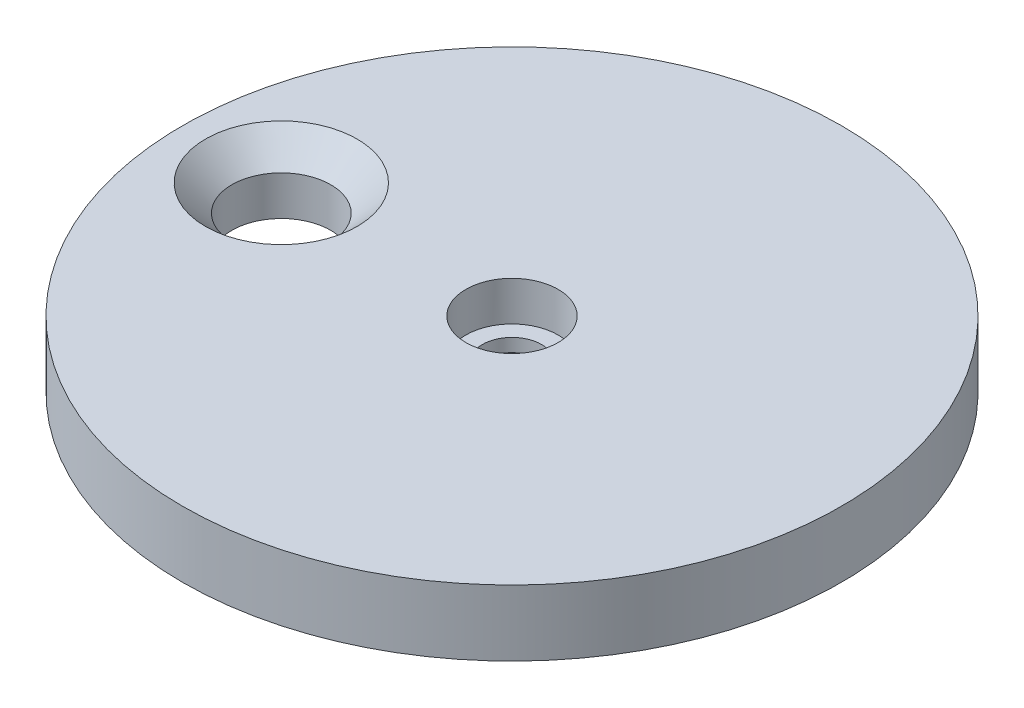
from build123d import *

# Parameters (mm, degrees)
SKETCH1_R           = 50
SKETCH1_R_2         = 7.5
BOSS_EXTRUDE1_DEPTH = 10
CHAMFER1_SIZE       = 4
CUT_EXTRUDE1_DEPTH  = 2
CUT_EXTRUDE2_REACH  = 73.162
SKETCH3_R           = 4.5
SKETCH4_R           = 1
CUT_EXTRUDE3_DEPTH  = 7
SKETCH7_R           = 7
CUT_EXTRUDE4_DEPTH  = 6


with BuildPart() as part:
    # Sketch1 → Boss-Extrude1 (new body)
    with BuildSketch(Plane(origin=(0, 0, 0), x_dir=(1, 0, 0), z_dir=(0, 1, 0))):
        with Locations(Location((0, 0, 0), (0, 0, 270))):
            Circle(SKETCH1_R)
        with Locations(Location((-35, 0, 0), (0, 0, 270))):
            Circle(SKETCH1_R_2, mode=Mode.SUBTRACT)
    extrude(amount=BOSS_EXTRUDE1_DEPTH)

    # Chamfer1
    chamfer1_edges = [part.edges().sort_by_distance(p)[0] for p in [
        (-35, 10, -7.5),
    ]]
    chamfer(chamfer1_edges, length=CHAMFER1_SIZE)

    # Sketch2 → Cut-Extrude1 (cut)
    with BuildSketch(Plane.XZ):
        with BuildLine():
            Line((-17, -2.5), (-4.43, -4.43))
            Line((-4.43, -4.43), (-2.5, -17))
            ThreePointArc((-2.5, -17), (0, -19.5), (2.5, -17))
            Line((2.5, -17), (4.43, -4.43))
            Line((4.43, -4.43), (17, -2.5))
            ThreePointArc((17, -2.5), (19.5, 0), (17, 2.5))
            Line((17, 2.5), (4.43, 4.43))
            Line((4.43, 4.43), (2.5, 17))
            ThreePointArc((2.5, 17), (0, 19.5), (-2.5, 17))
            Line((-2.5, 17), (-4.43, 4.43))
            Line((-4.43, 4.43), (-17, 2.5))
            ThreePointArc((-17, 2.5), (-19.5, 0), (-17, -2.5))
        make_face()
    extrude(amount=-CUT_EXTRUDE1_DEPTH, mode=Mode.SUBTRACT)

    # Sketch3 → Cut-Extrude2 (cut, up to next)
    with BuildSketch(Plane.XZ.offset(-2), mode=Mode.PRIVATE) as cut_extrude2_sk1:
        with Locations(Location((0, 0, 0), (0, 0, 270))):
            Circle(SKETCH3_R)
    cut_extrude2_tool1 = extrude(cut_extrude2_sk1.sketch, amount=-CUT_EXTRUDE2_REACH, mode=Mode.PRIVATE) & part.part
    add(cut_extrude2_tool1.solids().sort_by_distance((0, 2, 0))[0], mode=Mode.SUBTRACT)

    # Sketch4 → Cut-Extrude3 (cut)
    with BuildSketch(Plane.XZ.offset(-2)):
        with Locations(Location((-16, 0, 0), (0, 0, 270))):
            Circle(SKETCH4_R)
        with Locations(Location((0, 16, 0), (0, 0, 270))):
            Circle(SKETCH4_R)
        with Locations(Location((16, 0, 0), (0, 0, 270))):
            Circle(SKETCH4_R)
        with Locations(Location((0, -16, 0), (0, 0, 270))):
            Circle(SKETCH4_R)
    extrude(amount=-CUT_EXTRUDE3_DEPTH, mode=Mode.SUBTRACT)

    # Sketch7 → Cut-Extrude4 (cut)
    with BuildSketch(Plane(origin=(0, 10, 0), x_dir=(1, 0, 0), z_dir=(0, 1, 0))):
        with Locations(Location((0, 0, 0), (0, 0, 270))):
            Circle(SKETCH7_R)
    extrude(amount=-CUT_EXTRUDE4_DEPTH, mode=Mode.SUBTRACT)


solid = part.part
